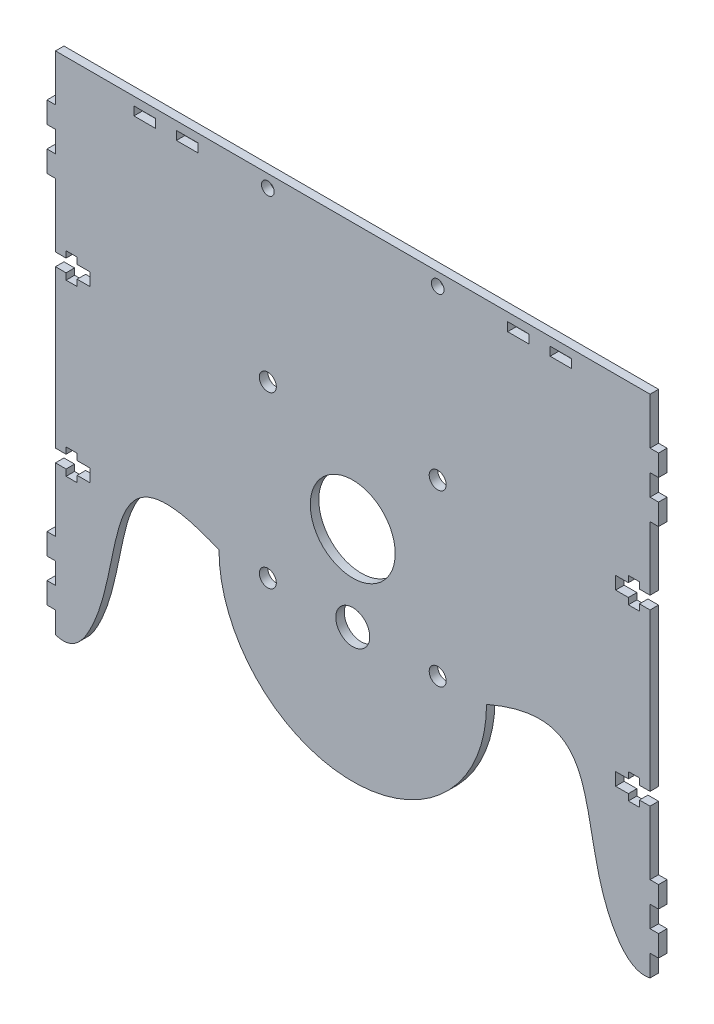
from build123d import *

# Parameters (mm, degrees)
SKETCH_1_R      = 10
SKETCH_1_R_2    = 4
SKETCH_1_R_3    = 1.5
SKETCH_1_R_4    = 2
SKETCH_1_W      = 5.05
SKETCH_1_H      = 2.05
EXTRUDE_1_DEPTH = 2


with BuildPart() as part:
    # 草图1 → 凸台-拉伸1 (new body)
    with BuildSketch(Plane.XY):
        with BuildLine():
            Line((317.453360513, 257.462931603), (317.453360513, 258.962931603))
            Line((317.453360513, 258.962931603), (314.853360513, 258.962931603))
            Line((314.853360513, 258.962931603), (314.853360513, 257.462931603))
            Line((314.853360513, 257.462931603), (311.853360513, 257.462931603))
            Line((311.853360513, 257.462931603), (311.853360513, 254.462931603))
            Line((311.853360513, 254.462931603), (314.853360513, 254.462931603))
            Line((314.853360513, 254.462931603), (314.853360513, 252.962931603))
            Line((314.853360513, 252.962931603), (317.453360513, 252.962931603))
            Line((317.453360513, 252.962931603), (317.453360513, 254.462931603))
            Line((317.453360513, 254.462931603), (319.953360513, 254.462931603))
            Line((319.953360513, 254.462931603), (319.953360513, 239.462931603))
            Line((319.953360513, 239.462931603), (321.953360513, 239.462931603))
            Line((321.953360513, 239.462931603), (321.953360513, 234.462931603))
            Line((321.953360513, 234.462931603), (319.953360513, 234.462931603))
            Line((319.953360513, 234.462931603), (319.953360513, 229.462931603))
            Line((319.953360513, 229.462931603), (321.953360513, 229.462931603))
            Line((321.953360513, 229.462931603), (321.953360513, 224.462931603))
            Line((321.953360513, 224.462931603), (319.953360513, 224.462931603))
            Line((319.953360513, 224.462931603), (319.953360513, 219.413055772))
            add(Edge.make_bspline(
                [(281.453360513, 255.962931603), (311.117403984, 268.788380876), (299.963906714, 235.827960028), (316.368347708, 218.592651753), (319.953360513, 219.413055772)],
                knots=[0, 0, 0, 0, 0.841205097, 1, 1, 1, 1], degree=3))
            ThreePointArc((281.453360513, 255.962931603), (249.953360513, 224.462931603), (218.453360513, 255.962931603))
            add(Edge.make_bspline(
                [(218.453360513, 255.962931603), (189.43429352, 268.354580122), (198.595511202, 236.610496326), (183.899274023, 218.075281385), (179.953360513, 219.413055772)],
                knots=[0, 0, 0, 0, 0.837139609, 1, 1, 1, 1], degree=3))
            Line((179.953360513, 219.413055772), (179.953360513, 224.462931603))
            Line((179.953360513, 224.462931603), (177.953360513, 224.462931603))
            Line((177.953360513, 224.462931603), (177.953360513, 229.462931603))
            Line((177.953360513, 229.462931603), (179.953360513, 229.462931603))
            Line((179.953360513, 229.462931603), (179.953360513, 234.462931603))
            Line((179.953360513, 234.462931603), (177.953360513, 234.462931603))
            Line((177.953360513, 234.462931603), (177.953360513, 239.462931603))
            Line((177.953360513, 239.462931603), (179.953360513, 239.462931603))
            Line((179.953360513, 239.462931603), (179.953360513, 254.462931603))
            Line((179.953360513, 254.462931603), (182.453360513, 254.462931603))
            Line((182.453360513, 254.462931603), (182.453360513, 252.962931602))
            Line((182.453360513, 252.962931602), (185.053360513, 252.962931602))
            Line((185.053360513, 252.962931602), (185.053360513, 254.462931603))
            Line((185.053360513, 254.462931603), (188.053360513, 254.462931603))
            Line((188.053360513, 254.462931603), (188.053360513, 257.462931603))
            Line((188.053360513, 257.462931603), (185.053360513, 257.462931603))
            Line((185.053360513, 257.462931603), (185.053360513, 258.962931602))
            Line((185.053360513, 258.962931602), (182.453360513, 258.962931602))
            Line((182.453360513, 258.962931602), (182.453360513, 257.462931603))
            Line((182.453360513, 257.462931603), (179.953360513, 257.462931603))
            Line((179.953360513, 257.462931603), (179.953360513, 294.462931603))
            Line((179.953360513, 294.462931603), (182.453360513, 294.462931603))
            Line((182.453360513, 294.462931603), (182.453360513, 292.962931603))
            Line((182.453360513, 292.962931603), (185.053360513, 292.962931603))
            Line((185.053360513, 292.962931603), (185.053360513, 294.462931603))
            Line((185.053360513, 294.462931603), (188.053360513, 294.462931603))
            Line((188.053360513, 294.462931603), (188.053360513, 297.462931603))
            Line((188.053360513, 297.462931603), (185.053360513, 297.462931603))
            Line((185.053360513, 297.462931603), (185.053360513, 298.962931603))
            Line((185.053360513, 298.962931603), (182.453360513, 298.962931603))
            Line((182.453360513, 298.962931603), (182.453360513, 297.462931603))
            Line((182.453360513, 297.462931603), (179.953360513, 297.462931603))
            Line((179.953360513, 297.462931603), (179.953360513, 312.462931603))
            Line((179.953360513, 312.462931603), (177.953360513, 312.462931603))
            Line((177.953360513, 312.462931603), (177.953360513, 317.462931603))
            Line((177.953360513, 317.462931603), (179.953360513, 317.462931603))
            Line((179.953360513, 317.462931603), (179.953360513, 322.462931603))
            Line((179.953360513, 322.462931603), (177.953360513, 322.462931603))
            Line((177.953360513, 322.462931603), (177.953360513, 327.462931603))
            Line((177.953360513, 327.462931603), (179.953360513, 327.462931603))
            Line((179.953360513, 327.462931603), (179.953360513, 338.462931603))
            Line((179.953360513, 338.462931603), (319.953360513, 338.462931603))
            Line((319.953360513, 338.462931603), (319.953360513, 327.462931603))
            Line((319.953360513, 327.462931603), (321.953360513, 327.462931603))
            Line((321.953360513, 327.462931603), (321.953360513, 322.462931603))
            Line((321.953360513, 322.462931603), (319.953360513, 322.462931603))
            Line((319.953360513, 322.462931603), (319.953360513, 317.462931603))
            Line((319.953360513, 317.462931603), (321.953360513, 317.462931603))
            Line((321.953360513, 317.462931603), (321.953360513, 312.462931603))
            Line((321.953360513, 312.462931603), (319.953360513, 312.462931603))
            Line((319.953360513, 312.462931603), (319.953360513, 297.462931603))
            Line((319.953360513, 297.462931603), (317.453360513, 297.462931603))
            Line((317.453360513, 297.462931603), (317.453360513, 298.962931603))
            Line((317.453360513, 298.962931603), (314.853360513, 298.962931603))
            Line((314.853360513, 298.962931603), (314.853360513, 297.462931603))
            Line((314.853360513, 297.462931603), (311.853360513, 297.462931603))
            Line((311.853360513, 297.462931603), (311.853360513, 294.462931603))
            Line((311.853360513, 294.462931603), (314.853360513, 294.462931603))
            Line((314.853360513, 294.462931603), (314.853360513, 292.962931603))
            Line((314.853360513, 292.962931603), (317.453360513, 292.962931603))
            Line((317.453360513, 292.962931603), (317.453360513, 294.462931603))
            Line((317.453360513, 294.462931603), (319.953360513, 294.462931603))
            Line((319.953360513, 294.462931603), (319.953360513, 257.462931603))
            Line((319.953360513, 257.462931603), (317.453360513, 257.462931603))
        make_face()
        with Locations((249.953360513, 275.962931603)):
            Circle(SKETCH_1_R, mode=Mode.SUBTRACT)
        with Locations((249.953360513, 255.962931603)):
            Circle(SKETCH_1_R_2, mode=Mode.SUBTRACT)
        with Locations((229.953360513, 335.462931603)):
            Circle(SKETCH_1_R_3, mode=Mode.SUBTRACT)
        with Locations((269.953360513, 335.462931603)):
            Circle(SKETCH_1_R_3, mode=Mode.SUBTRACT)
        with Locations((229.953360513, 255.962931603)):
            Circle(SKETCH_1_R_4, mode=Mode.SUBTRACT)
        with Locations((229.953360513, 295.962931603)):
            Circle(SKETCH_1_R_4, mode=Mode.SUBTRACT)
        with Locations((269.953360513, 295.962931603)):
            Circle(SKETCH_1_R_4, mode=Mode.SUBTRACT)
        with Locations((269.953360513, 255.962931603)):
            Circle(SKETCH_1_R_4, mode=Mode.SUBTRACT)
        with Locations((288.953360513, 335.462931603)):
            Rectangle(SKETCH_1_W, SKETCH_1_H, mode=Mode.SUBTRACT)
        with Locations((298.953360513, 335.462931603)):
            Rectangle(SKETCH_1_W, SKETCH_1_H, mode=Mode.SUBTRACT)
        with Locations((200.953360513, 335.462931603)):
            Rectangle(SKETCH_1_W, SKETCH_1_H, mode=Mode.SUBTRACT)
        with Locations((210.953360513, 335.462931603)):
            Rectangle(SKETCH_1_W, SKETCH_1_H, mode=Mode.SUBTRACT)
    extrude(amount=EXTRUDE_1_DEPTH)


solid = part.part
